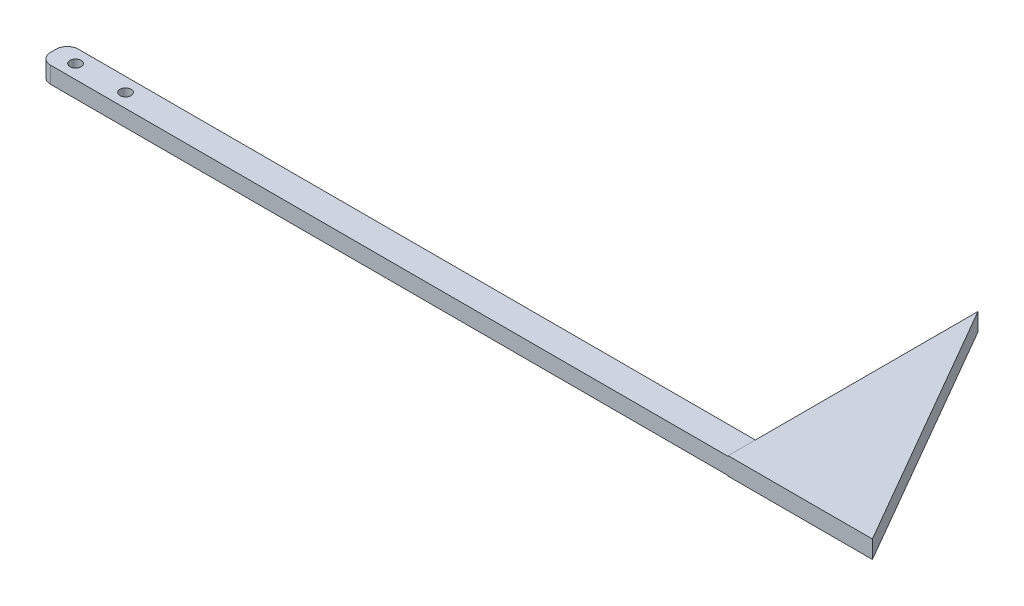
from build123d import *

# Parameters (mm, degrees)
SKETCH1_R           = 1
BOSS_EXTRUDE1_DEPTH = 3
FILLET1_R           = 2
BOSS_EXTRUDE2_DEPTH = 0.1
BOSS_EXTRUDE3_DEPTH = 0.1


with BuildPart() as part:
    # Sketch1 → Boss-Extrude1 (new body)
    with BuildSketch(Plane(origin=(0, 0, 0), x_dir=(1, 0, 0), z_dir=(0, 1, 0))):
        Polygon((0, 0), (150, 0), (124.019237886, 45), (124.019237886, 5), (0, 5), align=None)
        with Locations(Location((4, 2.5, 0), (0, 0, 270))):
            Circle(SKETCH1_R, mode=Mode.SUBTRACT)
        with Locations(Location((13, 2.5, 0), (0, 0, 270))):
            Circle(SKETCH1_R, mode=Mode.SUBTRACT)
    extrude(amount=BOSS_EXTRUDE1_DEPTH)

    # Fillet1
    fillet1_edges = [part.edges().sort_by_distance(p)[0] for p in [
        (0, 1.5, -5),
        (0, 1.5, 0),
    ]]
    fillet(fillet1_edges, radius=FILLET1_R)

    # Sketch2 → Boss-Extrude2 (add)
    with BuildSketch(Plane(origin=(0, 3, 0), x_dir=(1, 0, 0), z_dir=(0, 1, 0))):
        Polygon((150, 0), (124.019237886, 45), (124.019237886, 0), align=None)
    extrude(amount=BOSS_EXTRUDE2_DEPTH)

    # Sketch3 → Boss-Extrude3 (add)
    with BuildSketch(Plane.XZ):
        Polygon((124.019237886, -45), (150, 0), (124.019237886, 0), align=None)
    extrude(amount=BOSS_EXTRUDE3_DEPTH)


solid = part.part
